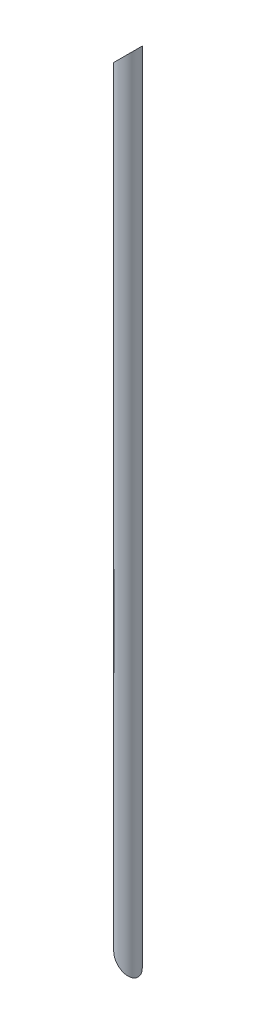
from build123d import *

# Parameters (mm, degrees)
ESBO_O2_W                  = 31.75
ESBO_O2_H                  = 2530.71
CORTE_EXTRUS_O1_DEPTH      = 2532.108300547
CORTE_EXTRUS_O1_DEPTH_BACK = 2532.108300547
ESBO_O9_R                  = 30.75
CORTE_EXTRUS_O6_DEPTH      = 2532.108300547


with BuildPart() as part:
    # Esboço2 → Revolução2 (revolve)
    with BuildSketch(Plane.XY):
        with Locations((15.875, 1265.355)):
            Rectangle(ESBO_O2_W, ESBO_O2_H)
    revolve(axis=Axis((0, 0, 0), (0, 1, 0)))

    # Esboço3 → Corte-extrusão1 (cut, two sides: drawn at the far end of the back side and taken through both)
    with BuildSketch(Plane.XY.offset(-CORTE_EXTRUS_O1_DEPTH_BACK)):
        Polygon((-31.75, 2530.71), (31.75, 2530.71), (-31.75, 2467.21), align=None)
        Polygon((31.75, 0), (-31.75, 63.5), (-31.75, 0), align=None)
    extrude(amount=CORTE_EXTRUS_O1_DEPTH + CORTE_EXTRUS_O1_DEPTH_BACK, mode=Mode.SUBTRACT)

    # Esboço9 → Corte-extrusão6 (cut, through all)
    with BuildSketch(Plane(origin=(0, 0, 0), x_dir=(1, 0, 0), z_dir=(0, 1, 0))):
        Circle(ESBO_O9_R)
    extrude(amount=CORTE_EXTRUS_O6_DEPTH, mode=Mode.SUBTRACT)


solid = part.part
